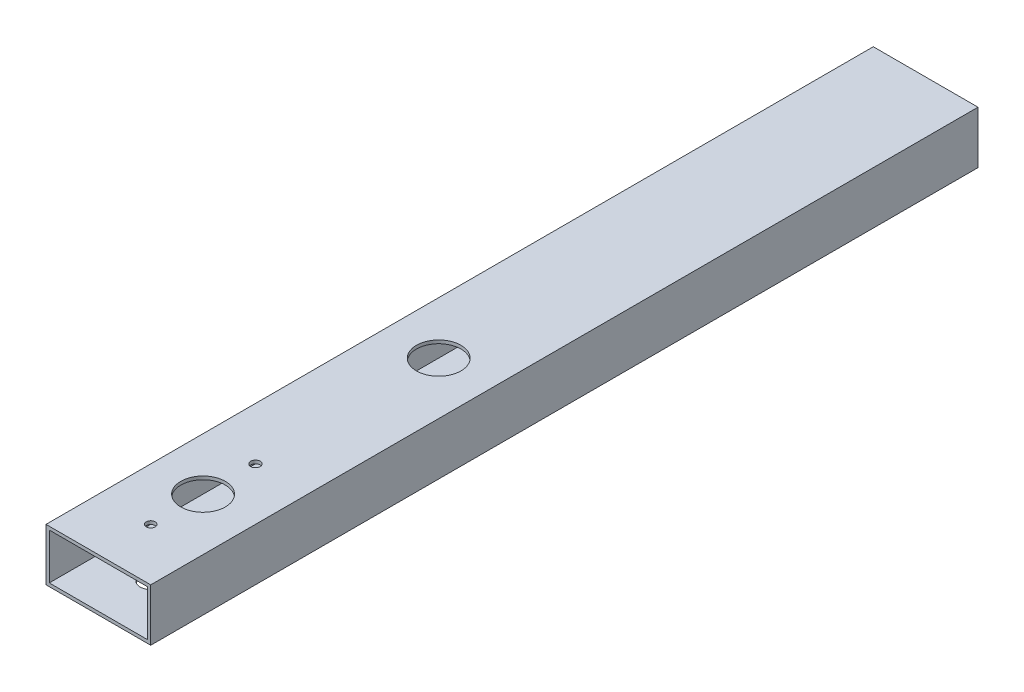
from build123d import *

# Parameters (mm, degrees)
SKETCH1_W           = 50.8
SKETCH1_H           = 25.4
SKETCH1_W_2         = 47.625
SKETCH1_H_2         = 22.225
BOSS_EXTRUDE1_DEPTH = 401.32
SKETCH2_R           = 10.795
CUT_EXTRUDE1_DEPTH  = 2.54
SKETCH3_R           = 10.795
CUT_EXTRUDE2_DEPTH  = 4.92
SKETCH5_R           = 14.351
CUT_EXTRUDE3_DEPTH  = 12.7
SKETCH6_R           = 14.351
CUT_EXTRUDE4_DEPTH  = 12.7
SKETCH7_R           = 2.159
CUT_EXTRUDE5_DEPTH  = 2.54
SKETCH9_R           = 5.08
CUT_EXTRUDE6_DEPTH  = 2.54
SKETCH10_R          = 2.286
CUT_EXTRUDE7_DEPTH  = 2.54
SKETCH11_R          = 5.08
CUT_EXTRUDE8_DEPTH  = 2.54


with BuildPart() as part:
    # Sketch1 → Boss-Extrude1 (new body)
    with BuildSketch(Plane.XY):
        with Locations((25.4, 12.7)):
            Rectangle(SKETCH1_W, SKETCH1_H)
        with Locations((25.4, 12.7)):
            Rectangle(SKETCH1_W_2, SKETCH1_H_2, mode=Mode.SUBTRACT)
    extrude(amount=BOSS_EXTRUDE1_DEPTH)

    # Sketch2 → Cut-Extrude1 (cut)
    with BuildSketch(Plane(origin=(0, 25.4, 0), x_dir=(1, 0, 0), z_dir=(0, 1, 0))):
        with Locations(Location((25.4, -236.22, 0), (0, 0, 270))):
            Circle(SKETCH2_R)
    extrude(amount=-CUT_EXTRUDE1_DEPTH, mode=Mode.SUBTRACT)

    # Sketch3 → Cut-Extrude2 (cut)
    with BuildSketch(Plane(origin=(0, 25.4, 0), x_dir=(1, 0, 0), z_dir=(0, 1, 0))):
        with Locations(Location((25.4, -350.52, 0), (0, 0, 270))):
            Circle(SKETCH3_R)
    extrude(amount=-CUT_EXTRUDE2_DEPTH, mode=Mode.SUBTRACT)

    # Sketch5 → Cut-Extrude3 (cut)
    with BuildSketch(Plane(origin=(0, 1.5875, 0), x_dir=(1, 0, 0), z_dir=(0, 1, 0))):
        with Locations(Location((25.4, -236.22, 0), (0, 0, 270))):
            Circle(SKETCH5_R)
    extrude(amount=-CUT_EXTRUDE3_DEPTH, mode=Mode.SUBTRACT)

    # Sketch6 → Cut-Extrude4 (cut)
    with BuildSketch(Plane(origin=(0, 1.5875, 0), x_dir=(1, 0, 0), z_dir=(0, 1, 0))):
        with Locations(Location((25.4, -350.52, 0), (0, 0, 270))):
            Circle(SKETCH6_R)
    extrude(amount=-CUT_EXTRUDE4_DEPTH, mode=Mode.SUBTRACT)

    # Sketch7 → Cut-Extrude5 (cut)
    with BuildSketch(Plane(origin=(0, 25.4, 0), x_dir=(1, 0, 0), z_dir=(0, 1, 0))):
        with Locations(Location((25.4, -375.92, 0), (0, 0, 270))):
            Circle(SKETCH7_R)
    extrude(amount=-CUT_EXTRUDE5_DEPTH, mode=Mode.SUBTRACT)

    # Sketch9 → Cut-Extrude6 (cut)
    with BuildSketch(Plane(origin=(0, 1.5875, 0), x_dir=(1, 0, 0), z_dir=(0, 1, 0))):
        with Locations(Location((25.4, -375.92, 0), (0, 0, 270))):
            Circle(SKETCH9_R)
    extrude(amount=-CUT_EXTRUDE6_DEPTH, mode=Mode.SUBTRACT)

    # Sketch10 → Cut-Extrude7 (cut)
    with BuildSketch(Plane(origin=(0, 25.4, 0), x_dir=(1, 0, 0), z_dir=(0, 1, 0))):
        with Locations(Location((25.4, -325.12, 0), (0, 0, 270))):
            Circle(SKETCH10_R)
    extrude(amount=-CUT_EXTRUDE7_DEPTH, mode=Mode.SUBTRACT)

    # Sketch11 → Cut-Extrude8 (cut)
    with BuildSketch(Plane(origin=(0, 1.5875, 0), x_dir=(1, 0, 0), z_dir=(0, 1, 0))):
        with Locations(Location((25.4, -325.12, 0), (0, 0, 270))):
            Circle(SKETCH11_R)
    extrude(amount=-CUT_EXTRUDE8_DEPTH, mode=Mode.SUBTRACT)


solid = part.part
